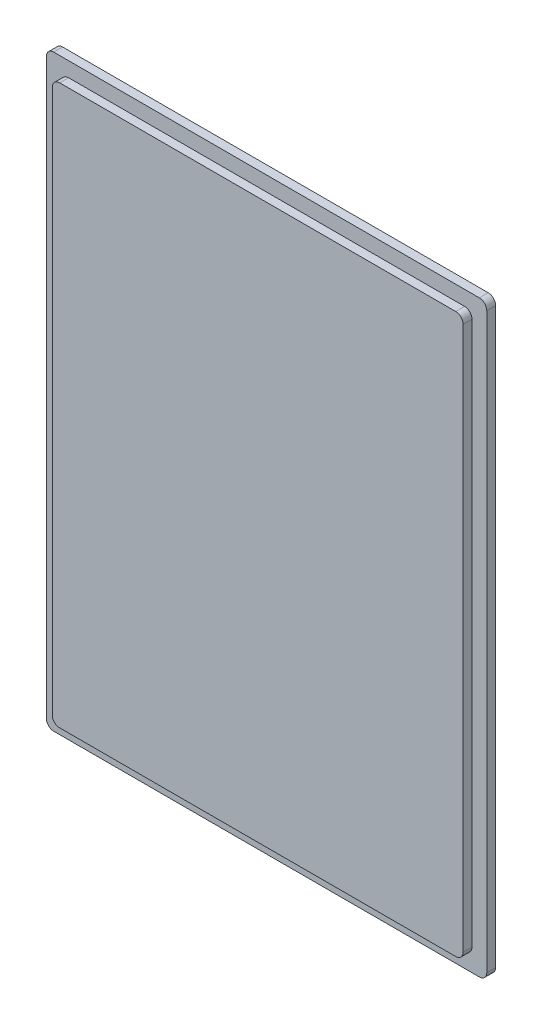
from build123d import *

# Parameters (mm, degrees)
BOSS_EXTRUDE1_DEPTH = 6
BOSS_EXTRUDE2_DEPTH = 6


with BuildPart() as part:
    # Sketch1 → Boss-Extrude1 (new body)
    with BuildSketch(Plane.XY):
        with BuildLine():
            Line((-49.804736885, 16.53410644), (-49.804736885, -371.46589356))
            ThreePointArc((-49.804736885, -371.46589356), (-48.340270791, -375.001427466), (-44.804736885, -376.46589356))
            Line((-44.804736885, -376.46589356), (243.195263115, -376.46589356))
            ThreePointArc((243.195263115, -376.46589356), (246.730797021, -375.001427466), (248.195263115, -371.46589356))
            Line((248.195263115, -371.46589356), (248.195263115, 16.53410644))
            ThreePointArc((248.195263115, 16.53410644), (246.730797021, 20.069640346), (243.195263115, 21.53410644))
            Line((243.195263115, 21.53410644), (-44.804736885, 21.53410644))
            ThreePointArc((-44.804736885, 21.53410644), (-48.340270791, 20.069640346), (-49.804736885, 16.53410644))
        make_face()
    extrude(amount=BOSS_EXTRUDE1_DEPTH)

    # Sketch2 → Boss-Extrude2 (add)
    with BuildSketch(Plane.XY.offset(6)):
        with BuildLine():
            Line((-39.804736885, 6.53410644), (-39.804736885, -361.46589356))
            ThreePointArc((-39.804736885, -361.46589356), (-38.340270791, -365.001427466), (-34.804736885, -366.46589356))
            Line((-34.804736885, -366.46589356), (233.195263115, -366.46589356))
            ThreePointArc((233.195263115, -366.46589356), (236.730797021, -365.001427466), (238.195263115, -361.46589356))
            Line((238.195263115, -361.46589356), (238.195263115, 6.53410644))
            ThreePointArc((238.195263115, 6.53410644), (236.730797021, 10.069640346), (233.195263115, 11.53410644))
            Line((233.195263115, 11.53410644), (-34.804736885, 11.53410644))
            ThreePointArc((-34.804736885, 11.53410644), (-38.340270791, 10.069640346), (-39.804736885, 6.53410644))
        make_face()
    extrude(amount=BOSS_EXTRUDE2_DEPTH)


solid = part.part
